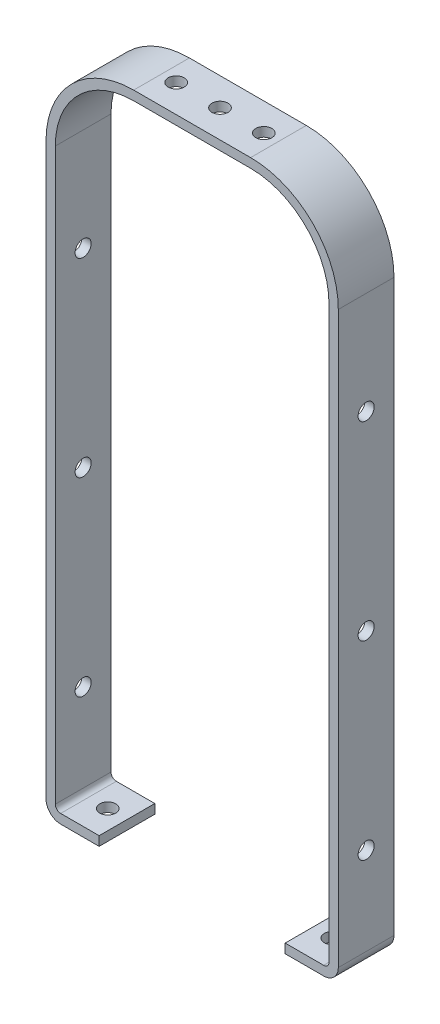
from build123d import *

# Parameters (mm, degrees)
BOSS_EXTRUDE1_DEPTH     = 9.525
SKETCH12_R              = 2.75
CUT_EXTRUDE2_DEPTH      = 236.564695201
CUT_EXTRUDE3_DEPTH      = 289.081109455
CUT_EXTRUDE3_DEPTH_BACK = 289.081109455
SKETCH13_R              = 2.75
CUT_EXTRUDE6_REACH      = 237.565
SKETCH16_R              = 2.75


with BuildPart() as part:
    # Sketch1 → Boss-Extrude1 (new, symmetric)
    with BuildSketch(Plane.XY):
        with BuildLine():
            Line((50, 45), (50, 240))
            ThreePointArc((50, 240), (41.213203436, 261.213203436), (20, 270))
            Line((20, 270), (-20, 270))
            ThreePointArc((-20, 270), (-41.213203436, 261.213203436), (-50, 240))
            Line((-50, 240), (-50, 45))
            ThreePointArc((-50, 45), (-48.535533906, 41.464466094), (-45, 40))
            Line((-45, 40), (-31.825, 40))
            Line((-31.825, 40), (-31.825, 43.175))
            Line((-31.825, 43.175), (-45, 43.175))
            ThreePointArc((-45, 43.175), (-46.290469876, 43.709530124), (-46.825, 45))
            Line((-46.825, 45), (-46.825, 240))
            ThreePointArc((-46.825, 240), (-38.968139405, 258.968139405), (-20, 266.825))
            Line((-20, 266.825), (20, 266.825))
            ThreePointArc((20, 266.825), (38.968139405, 258.968139405), (46.825, 240))
            Line((46.825, 240), (46.825, 45))
            ThreePointArc((46.825, 45), (46.290469876, 43.709530124), (45, 43.175))
            Line((45, 43.175), (31.825, 43.175))
            Line((31.825, 43.175), (31.825, 40))
            Line((31.825, 40), (45, 40))
            ThreePointArc((45, 40), (48.535533906, 41.464466094), (50, 45))
        make_face()
    extrude(amount=BOSS_EXTRUDE1_DEPTH, both=True)

    # Sketch12 → Cut-Extrude2 (cut, through all)
    with BuildSketch(Plane(origin=(0, 270, 0), x_dir=(1, 0, 0), z_dir=(0, 1, 0))):
        with Locations(Location((0, 0, 0), (0, 0, 270))):
            Circle(SKETCH12_R)
        with Locations(Location((-15, 0, 0), (0, 0, 270))):
            Circle(SKETCH12_R)
        with Locations(Location((15, 0, 0), (0, 0, 270))):
            Circle(SKETCH12_R)
    extrude(amount=-CUT_EXTRUDE2_DEPTH, mode=Mode.SUBTRACT)

    # Sketch13 → Cut-Extrude3 (cut, two sides: drawn at the far end of the back side and taken through both)
    with BuildSketch(Plane(origin=(50, 0, 0), x_dir=(0, 0, -1), z_dir=(1, 0, 0)).offset(-CUT_EXTRUDE3_DEPTH_BACK)):
        with Locations(Location((0, 205, 0), (0, 0, 90))):
            Circle(SKETCH13_R)
        with Locations(Location((0, 140, 0), (0, 0, 90))):
            Circle(SKETCH13_R)
        with Locations(Location((0, 75, 0), (0, 0, 90))):
            Circle(SKETCH13_R)
    extrude(amount=CUT_EXTRUDE3_DEPTH + CUT_EXTRUDE3_DEPTH_BACK, mode=Mode.SUBTRACT)

    # Sketch16 → Cut-Extrude6 (cut, up to next)
    with BuildSketch(Plane(origin=(0, 40, 0), x_dir=(-1, 0, 0), z_dir=(0, -1, 0)), mode=Mode.PRIVATE) as cut_extrude6_sk1:
        with Locations(Location((38.4125, 0, 0), (0, 0, 180))):
            Circle(SKETCH16_R)
    cut_extrude6_tool1 = extrude(cut_extrude6_sk1.sketch, amount=-CUT_EXTRUDE6_REACH, mode=Mode.PRIVATE) & part.part
    # Sketch16 → Cut-Extrude6 (cut, up to next)
    with BuildSketch(Plane(origin=(0, 40, 0), x_dir=(-1, 0, 0), z_dir=(0, -1, 0)), mode=Mode.PRIVATE) as cut_extrude6_sk2:
        with Locations(Location((-38.4125, 0, 0), (0, 0, 180))):
            Circle(SKETCH16_R)
    cut_extrude6_tool2 = extrude(cut_extrude6_sk2.sketch, amount=-CUT_EXTRUDE6_REACH, mode=Mode.PRIVATE) & part.part
    add(cut_extrude6_tool1.solids().sort_by_distance((-38.4125, 40, 0))[0], mode=Mode.SUBTRACT)
    add(cut_extrude6_tool2.solids().sort_by_distance((38.4125, 40, 0))[0], mode=Mode.SUBTRACT)


solid = part.part
